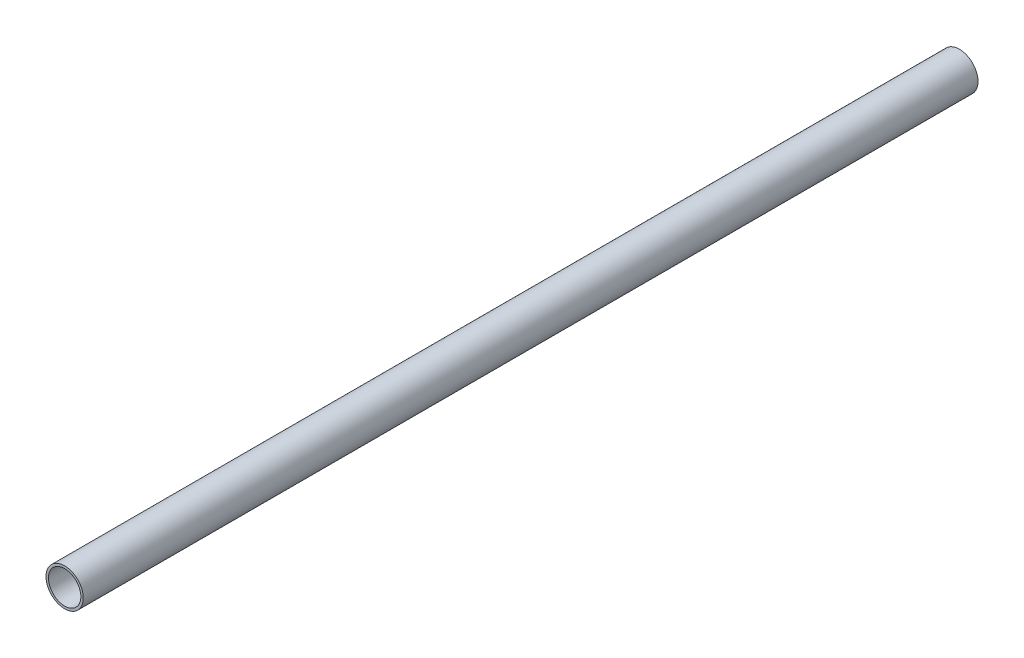
from build123d import *

# Parameters (mm, degrees)
SKETCH1_R           = 12.7
SKETCH1_R_2         = 11.049
BOSS_EXTRUDE1_DEPTH = 609.6
SKETCH2_R           = 11.0998
SKETCH2_R_2         = 11.049
CUT_EXTRUDE1_DEPTH  = 50.8


with BuildPart() as part:
    # Sketch1 → Boss-Extrude1 (new body)
    with BuildSketch(Plane.XY):
        with Locations(Location((0, 0, 0), (0, 0, 180))):
            Circle(SKETCH1_R)
        with Locations(Location((0, 0, 0), (0, 0, 180))):
            Circle(SKETCH1_R_2, mode=Mode.SUBTRACT)
    extrude(amount=BOSS_EXTRUDE1_DEPTH)

    # Sketch2 → Cut-Extrude1 (cut)
    with BuildSketch(Plane.XY):
        Circle(SKETCH2_R)
        with Locations(Location((0, 0, 0), (0, 0, 180))):
            Circle(SKETCH2_R_2, mode=Mode.SUBTRACT)
    extrude(amount=CUT_EXTRUDE1_DEPTH, mode=Mode.SUBTRACT)


solid = part.part
